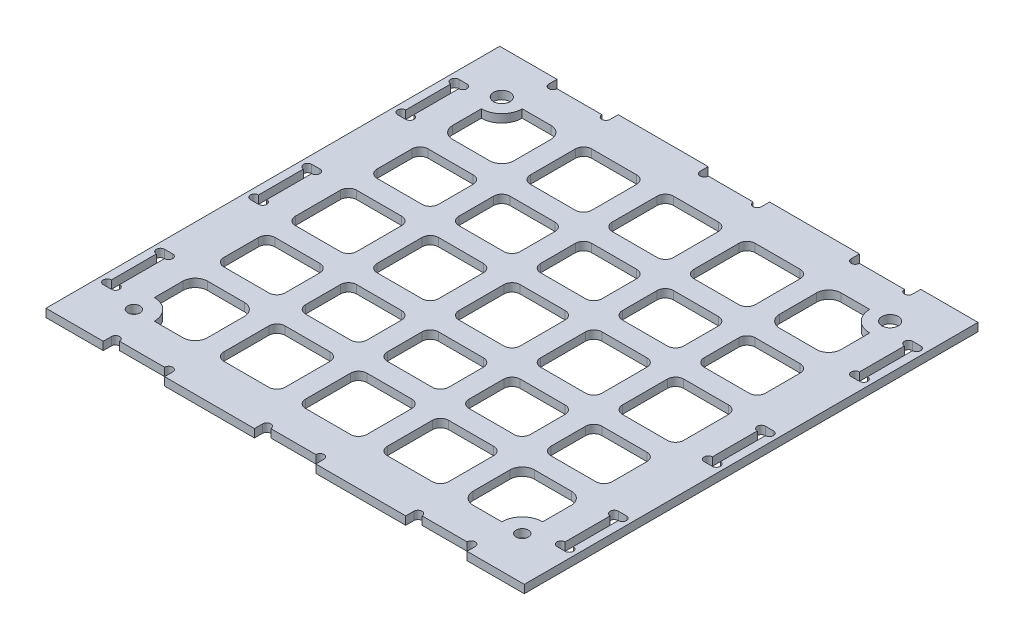
from build123d import *

# Parameters (mm, degrees)
SKETCH_1_W          = 109
SKETCH_1_H          = 107
SKETCH_1_R          = 2
SKETCH_1_R_2        = 1.5
EXTRUDE_1_DEPTH     = 2
SKETCH_2_W          = 22
SKETCH_2_H          = 2
SKETCH_2_W_2        = 2
SKETCH_2_H_2        = 21
EXTRUDE_2_DEPTH     = 2
CUT_EXTRUDE_1_DEPTH = 156.582775396
CUT_EXTRUDE_2_DEPTH = 156.582775396
EXTRUDE_4_DEPTH     = 2


with BuildPart() as part:
    # 草图1 → 凸台-拉伸1 (new body)
    with BuildSketch(Plane(origin=(0, 0, 0), x_dir=(1, 0, 0), z_dir=(0, 1, 0))):
        with Locations((54.5, 53.5)):
            Rectangle(SKETCH_1_W, SKETCH_1_H)
        with Locations(Location((7, 98.5, 0), (0, 0, 270))):
            Circle(SKETCH_1_R, mode=Mode.SUBTRACT)
        with Locations(Location((102, 98.5, 0), (0, 0, 270))):
            Circle(SKETCH_1_R, mode=Mode.SUBTRACT)
        with Locations(Location((102, 8.5, 0), (0, 0, 270))):
            Circle(SKETCH_1_R_2, mode=Mode.SUBTRACT)
        with Locations(Location((7, 8.5, 0), (0, 0, 270))):
            Circle(SKETCH_1_R_2, mode=Mode.SUBTRACT)
    extrude(amount=EXTRUDE_1_DEPTH)

    # 草图2 → 凸台-拉伸2 (add)
    with BuildSketch(Plane(origin=(0, 2, 0), x_dir=(1, 0, 0), z_dir=(0, 1, 0))):
        Polygon((10, 107), (10, 109), (-2, 109), (-2, 97), (0, 97), (0, 107), align=None)
        with Locations((36, 108)):
            Rectangle(SKETCH_2_W, SKETCH_2_H)
        with Locations((73, 108)):
            Rectangle(SKETCH_2_W, SKETCH_2_H)
        Polygon((99, 107), (99, 109), (111, 109), (111, 97), (109, 97), (109, 107), align=None)
        with Locations((110, 35.5)):
            Rectangle(SKETCH_2_W_2, SKETCH_2_H_2)
        with Locations((-1, 71.5)):
            Rectangle(SKETCH_2_W_2, SKETCH_2_H_2)
        with Locations((-1, 35.5)):
            Rectangle(SKETCH_2_W_2, SKETCH_2_H_2)
        with Locations((110, 71.5)):
            Rectangle(SKETCH_2_W_2, SKETCH_2_H_2)
        Polygon((111, -2), (111, 10), (109, 10), (109, 0), (99, 0), (99, -2), align=None)
        with Locations((73, -1)):
            Rectangle(SKETCH_2_W, SKETCH_2_H)
        with Locations((36, -1)):
            Rectangle(SKETCH_2_W, SKETCH_2_H)
        Polygon((-2, -2), (-2, 10), (0, 10), (0, 0), (10, 0), (10, -2), align=None)
    extrude(amount=-EXTRUDE_2_DEPTH)

    # 草图4 → 切除-拉伸1 (cut, through all)
    with BuildSketch(Plane(origin=(0, 2, 0), x_dir=(1, 0, 0), z_dir=(0, 1, 0))):
        with BuildLine():
            Line((10, 107), (12, 107))
            ThreePointArc((12, 107), (11, 106), (10, 107))
        make_face()
        with BuildLine():
            Line((25, 107), (23, 107))
            ThreePointArc((23, 107), (24, 106), (25, 107))
        make_face()
        with BuildLine():
            Line((47, 107), (49, 107))
            ThreePointArc((49, 107), (48, 106), (47, 107))
        make_face()
        with BuildLine():
            Line((62, 107), (60, 107))
            ThreePointArc((60, 107), (61, 106), (62, 107))
        make_face()
        with BuildLine():
            Line((84, 107), (86, 107))
            ThreePointArc((86, 107), (85, 106), (84, 107))
        make_face()
        with BuildLine():
            Line((99, 107), (97, 107))
            ThreePointArc((97, 107), (98, 106), (99, 107))
        make_face()
        with BuildLine():
            Line((0, 84), (0, 82))
            ThreePointArc((0, 82), (1, 83), (0, 84))
        make_face()
        with BuildLine():
            Line((99, 0), (97, 0))
            ThreePointArc((97, 0), (98, 1), (99, 0))
        make_face()
        with BuildLine():
            Line((84, 0), (86, 0))
            ThreePointArc((86, 0), (85, 1), (84, 0))
        make_face()
        with BuildLine():
            Line((62, 0), (60, 0))
            ThreePointArc((60, 0), (61, 1), (62, 0))
        make_face()
        with BuildLine():
            Line((47, 0), (49, 0))
            ThreePointArc((49, 0), (48, 1), (47, 0))
        make_face()
        with BuildLine():
            Line((25, 0), (23, 0))
            ThreePointArc((23, 0), (24, 1), (25, 0))
        make_face()
        with BuildLine():
            Line((10, 0), (12, 0))
            ThreePointArc((12, 0), (11, 1), (10, 0))
        make_face()
        with BuildLine():
            Line((0, 95), (0, 97))
            ThreePointArc((0, 97), (1, 96), (0, 95))
        make_face()
        with BuildLine():
            Line((0, 59), (0, 61))
            ThreePointArc((0, 61), (1, 60), (0, 59))
        make_face()
        with BuildLine():
            Line((0, 48), (0, 46))
            ThreePointArc((0, 46), (1, 47), (0, 48))
        make_face()
        with BuildLine():
            Line((0, 12), (0, 10))
            ThreePointArc((0, 10), (1, 11), (0, 12))
        make_face()
        with BuildLine():
            Line((0, 23), (0, 25))
            ThreePointArc((0, 25), (1, 24), (0, 23))
        make_face()
        with BuildLine():
            Line((109, 23), (109, 25))
            ThreePointArc((109, 25), (108, 24), (109, 23))
        make_face()
        with BuildLine():
            Line((109, 12), (109, 10))
            ThreePointArc((109, 10), (108, 11), (109, 12))
        make_face()
        with BuildLine():
            Line((109, 48), (109, 46))
            ThreePointArc((109, 46), (108, 47), (109, 48))
        make_face()
        with BuildLine():
            Line((109, 59), (109, 61))
            ThreePointArc((109, 61), (108, 60), (109, 59))
        make_face()
        with BuildLine():
            Line((109, 95), (109, 97))
            ThreePointArc((109, 97), (108, 96), (109, 95))
        make_face()
        with BuildLine():
            Line((109, 84), (109, 82))
            ThreePointArc((109, 82), (108, 83), (109, 84))
        make_face()
    extrude(amount=-CUT_EXTRUDE_1_DEPTH, mode=Mode.SUBTRACT)

    # 草图5 → 切除-拉伸2 (cut, through all)
    with BuildSketch(Plane(origin=(0, 2, 0), x_dir=(1, 0, 0), z_dir=(0, 1, 0))):
        with BuildLine():
            Line((12, 98.5), (19, 98.5))
            ThreePointArc((19, 98.5), (21.121320344, 97.621320344), (22, 95.5))
            Line((22, 95.5), (22, 86.5))
            ThreePointArc((22, 86.5), (21.121320344, 84.378679656), (19, 83.5))
            Line((19, 83.5), (10, 83.5))
            ThreePointArc((10, 83.5), (7.878679656, 84.378679656), (7, 86.5))
            Line((7, 86.5), (7, 93.5))
            ThreePointArc((7, 93.5), (10.535533906, 94.964466094), (12, 98.5))
        make_face()
        with BuildLine():
            Line((102, 86.5), (102, 93.5))
            ThreePointArc((102, 93.5), (98.464466094, 94.964466094), (97, 98.5))
            Line((97, 98.5), (90, 98.5))
            ThreePointArc((90, 98.5), (87.878679656, 97.621320344), (87, 95.5))
            Line((87, 95.5), (87, 86.5))
            ThreePointArc((87, 86.5), (87.878679656, 84.378679656), (90, 83.5))
            Line((90, 83.5), (99, 83.5))
            ThreePointArc((99, 83.5), (101.121320344, 84.378679656), (102, 86.5))
        make_face()
        with BuildLine():
            Line((97, 8.5), (90, 8.5))
            ThreePointArc((90, 8.5), (87.878679656, 9.378679656), (87, 11.5))
            Line((87, 11.5), (87, 20.5))
            ThreePointArc((87, 20.5), (87.878679656, 22.621320344), (90, 23.5))
            Line((90, 23.5), (99, 23.5))
            ThreePointArc((99, 23.5), (101.121320344, 22.621320344), (102, 20.5))
            Line((102, 20.5), (102, 13.5))
            ThreePointArc((102, 13.5), (98.464466094, 12.035533906), (97, 8.5))
        make_face()
        with BuildLine():
            Line((7, 20.5), (7, 13.5))
            ThreePointArc((7, 13.5), (10.535533906, 12.035533906), (12, 8.5))
            Line((12, 8.5), (19, 8.5))
            ThreePointArc((19, 8.5), (21.121320344, 9.378679656), (22, 11.5))
            Line((22, 11.5), (22, 20.5))
            ThreePointArc((22, 20.5), (21.121320344, 22.621320344), (19, 23.5))
            Line((19, 23.5), (10, 23.5))
            ThreePointArc((10, 23.5), (7.878679656, 22.621320344), (7, 20.5))
        make_face()
        with BuildLine():
            Line((80, 46), (69, 46))
            ThreePointArc((69, 46), (67.585786438, 46.585786438), (67, 48))
            Line((67, 48), (67, 59))
            ThreePointArc((67, 59), (67.585786438, 60.414213562), (69, 61))
            Line((69, 61), (80, 61))
            ThreePointArc((80, 61), (81.414213562, 60.414213562), (82, 59))
            Line((82, 59), (82, 48))
            ThreePointArc((82, 48), (81.414213562, 46.585786438), (80, 46))
        make_face()
        with BuildLine():
            Line((9, 78.5), (20, 78.5))
            ThreePointArc((20, 78.5), (21.414213562, 77.914213562), (22, 76.5))
            Line((22, 76.5), (22, 68))
            ThreePointArc((22, 68), (21.414213562, 66.585786438), (20, 66))
            Line((20, 66), (9, 66))
            ThreePointArc((9, 66), (7.585786438, 66.585786438), (7, 68))
            Line((7, 68), (7, 76.5))
            ThreePointArc((7, 76.5), (7.585786438, 77.914213562), (9, 78.5))
        make_face()
        with BuildLine():
            Line((9, 61), (20, 61))
            ThreePointArc((20, 61), (21.414213562, 60.414213562), (22, 59))
            Line((22, 59), (22, 48))
            ThreePointArc((22, 48), (21.414213562, 46.585786438), (20, 46))
            Line((20, 46), (9, 46))
            ThreePointArc((9, 46), (7.585786438, 46.585786438), (7, 48))
            Line((7, 48), (7, 59))
            ThreePointArc((7, 59), (7.585786438, 60.414213562), (9, 61))
        make_face()
        with BuildLine():
            Line((29, 78.5), (40, 78.5))
            ThreePointArc((40, 78.5), (41.414213562, 77.914213562), (42, 76.5))
            Line((42, 76.5), (42, 68))
            ThreePointArc((42, 68), (41.414213562, 66.585786438), (40, 66))
            Line((40, 66), (29, 66))
            ThreePointArc((29, 66), (27.585786438, 66.585786438), (27, 68))
            Line((27, 68), (27, 76.5))
            ThreePointArc((27, 76.5), (27.585786438, 77.914213562), (29, 78.5))
        make_face()
        with BuildLine():
            Line((29, 98.5), (40, 98.5))
            ThreePointArc((40, 98.5), (41.414213562, 97.914213562), (42, 96.5))
            Line((42, 96.5), (42, 85.5))
            ThreePointArc((42, 85.5), (41.414213562, 84.085786438), (40, 83.5))
            Line((40, 83.5), (29, 83.5))
            ThreePointArc((29, 83.5), (27.585786438, 84.085786438), (27, 85.5))
            Line((27, 85.5), (27, 96.5))
            ThreePointArc((27, 96.5), (27.585786438, 97.914213562), (29, 98.5))
        make_face()
        with BuildLine():
            Line((49, 98.5), (60, 98.5))
            ThreePointArc((60, 98.5), (61.414213562, 97.914213562), (62, 96.5))
            Line((62, 96.5), (62, 85.5))
            ThreePointArc((62, 85.5), (61.414213562, 84.085786438), (60, 83.5))
            Line((60, 83.5), (49, 83.5))
            ThreePointArc((49, 83.5), (47.585786438, 84.085786438), (47, 85.5))
            Line((47, 85.5), (47, 96.5))
            ThreePointArc((47, 96.5), (47.585786438, 97.914213562), (49, 98.5))
        make_face()
        with BuildLine():
            Line((49, 78.5), (60, 78.5))
            ThreePointArc((60, 78.5), (61.414213562, 77.914213562), (62, 76.5))
            Line((62, 76.5), (62, 68))
            ThreePointArc((62, 68), (61.414213562, 66.585786438), (60, 66))
            Line((60, 66), (49, 66))
            ThreePointArc((49, 66), (47.585786438, 66.585786438), (47, 68))
            Line((47, 68), (47, 76.5))
            ThreePointArc((47, 76.5), (47.585786438, 77.914213562), (49, 78.5))
        make_face()
        with BuildLine():
            Line((29, 61), (40, 61))
            ThreePointArc((40, 61), (41.414213562, 60.414213562), (42, 59))
            Line((42, 59), (42, 48))
            ThreePointArc((42, 48), (41.414213562, 46.585786438), (40, 46))
            Line((40, 46), (29, 46))
            ThreePointArc((29, 46), (27.585786438, 46.585786438), (27, 48))
            Line((27, 48), (27, 59))
            ThreePointArc((27, 59), (27.585786438, 60.414213562), (29, 61))
        make_face()
        with BuildLine():
            Line((49, 61), (60, 61))
            ThreePointArc((60, 61), (61.414213562, 60.414213562), (62, 59))
            Line((62, 59), (62, 48))
            ThreePointArc((62, 48), (61.414213562, 46.585786438), (60, 46))
            Line((60, 46), (49, 46))
            ThreePointArc((49, 46), (47.585786438, 46.585786438), (47, 48))
            Line((47, 48), (47, 59))
            ThreePointArc((47, 59), (47.585786438, 60.414213562), (49, 61))
        make_face()
        with BuildLine():
            Line((100, 46), (89, 46))
            ThreePointArc((89, 46), (87.585786438, 46.585786438), (87, 48))
            Line((87, 48), (87, 59))
            ThreePointArc((87, 59), (87.585786438, 60.414213562), (89, 61))
            Line((89, 61), (100, 61))
            ThreePointArc((100, 61), (101.414213562, 60.414213562), (102, 59))
            Line((102, 59), (102, 48))
            ThreePointArc((102, 48), (101.414213562, 46.585786438), (100, 46))
        make_face()
        with BuildLine():
            Line((100, 66), (89, 66))
            ThreePointArc((89, 66), (87.585786438, 66.585786438), (87, 68))
            Line((87, 68), (87, 76.5))
            ThreePointArc((87, 76.5), (87.585786438, 77.914213562), (89, 78.5))
            Line((89, 78.5), (100, 78.5))
            ThreePointArc((100, 78.5), (101.414213562, 77.914213562), (102, 76.5))
            Line((102, 76.5), (102, 68))
            ThreePointArc((102, 68), (101.414213562, 66.585786438), (100, 66))
        make_face()
        with BuildLine():
            Line((80, 66), (69, 66))
            ThreePointArc((69, 66), (67.585786438, 66.585786438), (67, 68))
            Line((67, 68), (67, 76.5))
            ThreePointArc((67, 76.5), (67.585786438, 77.914213562), (69, 78.5))
            Line((69, 78.5), (80, 78.5))
            ThreePointArc((80, 78.5), (81.414213562, 77.914213562), (82, 76.5))
            Line((82, 76.5), (82, 68))
            ThreePointArc((82, 68), (81.414213562, 66.585786438), (80, 66))
        make_face()
        with BuildLine():
            Line((80, 83.5), (69, 83.5))
            ThreePointArc((69, 83.5), (67.585786438, 84.085786438), (67, 85.5))
            Line((67, 85.5), (67, 96.5))
            ThreePointArc((67, 96.5), (67.585786438, 97.914213562), (69, 98.5))
            Line((69, 98.5), (80, 98.5))
            ThreePointArc((80, 98.5), (81.414213562, 97.914213562), (82, 96.5))
            Line((82, 96.5), (82, 85.5))
            ThreePointArc((82, 85.5), (81.414213562, 84.085786438), (80, 83.5))
        make_face()
        with BuildLine():
            Line((102, 30.5), (102, 39))
            ThreePointArc((102, 39), (101.414213562, 40.414213562), (100, 41))
            Line((100, 41), (89, 41))
            ThreePointArc((89, 41), (87.585786438, 40.414213562), (87, 39))
            Line((87, 39), (87, 30.5))
            ThreePointArc((87, 30.5), (87.585786438, 29.085786438), (89, 28.5))
            Line((89, 28.5), (100, 28.5))
            ThreePointArc((100, 28.5), (101.414213562, 29.085786438), (102, 30.5))
        make_face()
        with BuildLine():
            Line((82, 10.5), (82, 21.5))
            ThreePointArc((82, 21.5), (81.414213562, 22.914213562), (80, 23.5))
            Line((80, 23.5), (69, 23.5))
            ThreePointArc((69, 23.5), (67.585786438, 22.914213562), (67, 21.5))
            Line((67, 21.5), (67, 10.5))
            ThreePointArc((67, 10.5), (67.585786438, 9.085786438), (69, 8.5))
            Line((69, 8.5), (80, 8.5))
            ThreePointArc((80, 8.5), (81.414213562, 9.085786438), (82, 10.5))
        make_face()
        with BuildLine():
            Line((82, 30.5), (82, 39))
            ThreePointArc((82, 39), (81.414213562, 40.414213562), (80, 41))
            Line((80, 41), (69, 41))
            ThreePointArc((69, 41), (67.585786438, 40.414213562), (67, 39))
            Line((67, 39), (67, 30.5))
            ThreePointArc((67, 30.5), (67.585786438, 29.085786438), (69, 28.5))
            Line((69, 28.5), (80, 28.5))
            ThreePointArc((80, 28.5), (81.414213562, 29.085786438), (82, 30.5))
        make_face()
        with BuildLine():
            Line((49, 41), (60, 41))
            ThreePointArc((60, 41), (61.414213562, 40.414213562), (62, 39))
            Line((62, 39), (62, 30.5))
            ThreePointArc((62, 30.5), (61.414213562, 29.085786438), (60, 28.5))
            Line((60, 28.5), (49, 28.5))
            ThreePointArc((49, 28.5), (47.585786438, 29.085786438), (47, 30.5))
            Line((47, 30.5), (47, 39))
            ThreePointArc((47, 39), (47.585786438, 40.414213562), (49, 41))
        make_face()
        with BuildLine():
            Line((49, 23.5), (60, 23.5))
            ThreePointArc((60, 23.5), (61.414213562, 22.914213562), (62, 21.5))
            Line((62, 21.5), (62, 10.5))
            ThreePointArc((62, 10.5), (61.414213562, 9.085786438), (60, 8.5))
            Line((60, 8.5), (49, 8.5))
            ThreePointArc((49, 8.5), (47.585786438, 9.085786438), (47, 10.5))
            Line((47, 10.5), (47, 21.5))
            ThreePointArc((47, 21.5), (47.585786438, 22.914213562), (49, 23.5))
        make_face()
        with BuildLine():
            Line((29, 23.5), (40, 23.5))
            ThreePointArc((40, 23.5), (41.414213562, 22.914213562), (42, 21.5))
            Line((42, 21.5), (42, 10.5))
            ThreePointArc((42, 10.5), (41.414213562, 9.085786438), (40, 8.5))
            Line((40, 8.5), (29, 8.5))
            ThreePointArc((29, 8.5), (27.585786438, 9.085786438), (27, 10.5))
            Line((27, 10.5), (27, 21.5))
            ThreePointArc((27, 21.5), (27.585786438, 22.914213562), (29, 23.5))
        make_face()
        with BuildLine():
            Line((29, 41), (40, 41))
            ThreePointArc((40, 41), (41.414213562, 40.414213562), (42, 39))
            Line((42, 39), (42, 30.5))
            ThreePointArc((42, 30.5), (41.414213562, 29.085786438), (40, 28.5))
            Line((40, 28.5), (29, 28.5))
            ThreePointArc((29, 28.5), (27.585786438, 29.085786438), (27, 30.5))
            Line((27, 30.5), (27, 39))
            ThreePointArc((27, 39), (27.585786438, 40.414213562), (29, 41))
        make_face()
        with BuildLine():
            Line((9, 41), (20, 41))
            ThreePointArc((20, 41), (21.414213562, 40.414213562), (22, 39))
            Line((22, 39), (22, 30.5))
            ThreePointArc((22, 30.5), (21.414213562, 29.085786438), (20, 28.5))
            Line((20, 28.5), (9, 28.5))
            ThreePointArc((9, 28.5), (7.585786438, 29.085786438), (7, 30.5))
            Line((7, 30.5), (7, 39))
            ThreePointArc((7, 39), (7.585786438, 40.414213562), (9, 41))
        make_face()
    extrude(amount=-CUT_EXTRUDE_2_DEPTH, mode=Mode.SUBTRACT)

    # 草图6 → 凸台-拉伸4 (add)
    with BuildSketch(Plane(origin=(0, 2, 0), x_dir=(1, 0, 0), z_dir=(0, 1, 0))):
        with BuildLine():
            Line((-2, 95), (-2, 84))
            ThreePointArc((-2, 84), (-3, 83), (-2, 82))
            Line((-2, 82), (-2, 61))
            ThreePointArc((-2, 61), (-3, 60), (-2, 59))
            Line((-2, 59), (-2, 48))
            ThreePointArc((-2, 48), (-3, 47), (-2, 46))
            Line((-2, 46), (-2, 25))
            ThreePointArc((-2, 25), (-3, 24), (-2, 23))
            Line((-2, 23), (-2, 12))
            ThreePointArc((-2, 12), (-3, 11), (-2, 10))
            Line((-2, 10), (-2, -2))
            Line((-2, -2), (-4, -2))
            Line((-4, -2), (-4, 109))
            Line((-4, 109), (-2, 109))
            Line((-2, 109), (-2, 97))
            ThreePointArc((-2, 97), (-3, 96), (-2, 95))
        make_face()
        with BuildLine():
            Line((113, 109), (111, 109))
            Line((111, 109), (111, 97))
            ThreePointArc((111, 97), (112, 96), (111, 95))
            Line((111, 95), (111, 84))
            ThreePointArc((111, 84), (112, 83), (111, 82))
            Line((111, 82), (111, 61))
            ThreePointArc((111, 61), (112, 60), (111, 59))
            Line((111, 59), (111, 48))
            ThreePointArc((111, 48), (112, 47), (111, 46))
            Line((111, 46), (111, 25))
            ThreePointArc((111, 25), (112, 24), (111, 23))
            Line((111, 23), (111, 12))
            ThreePointArc((111, 12), (112, 11), (111, 10))
            Line((111, 10), (111, -2))
            Line((111, -2), (113, -2))
            Line((113, -2), (113, 109))
        make_face()
    extrude(amount=-EXTRUDE_4_DEPTH)


solid = part.part
